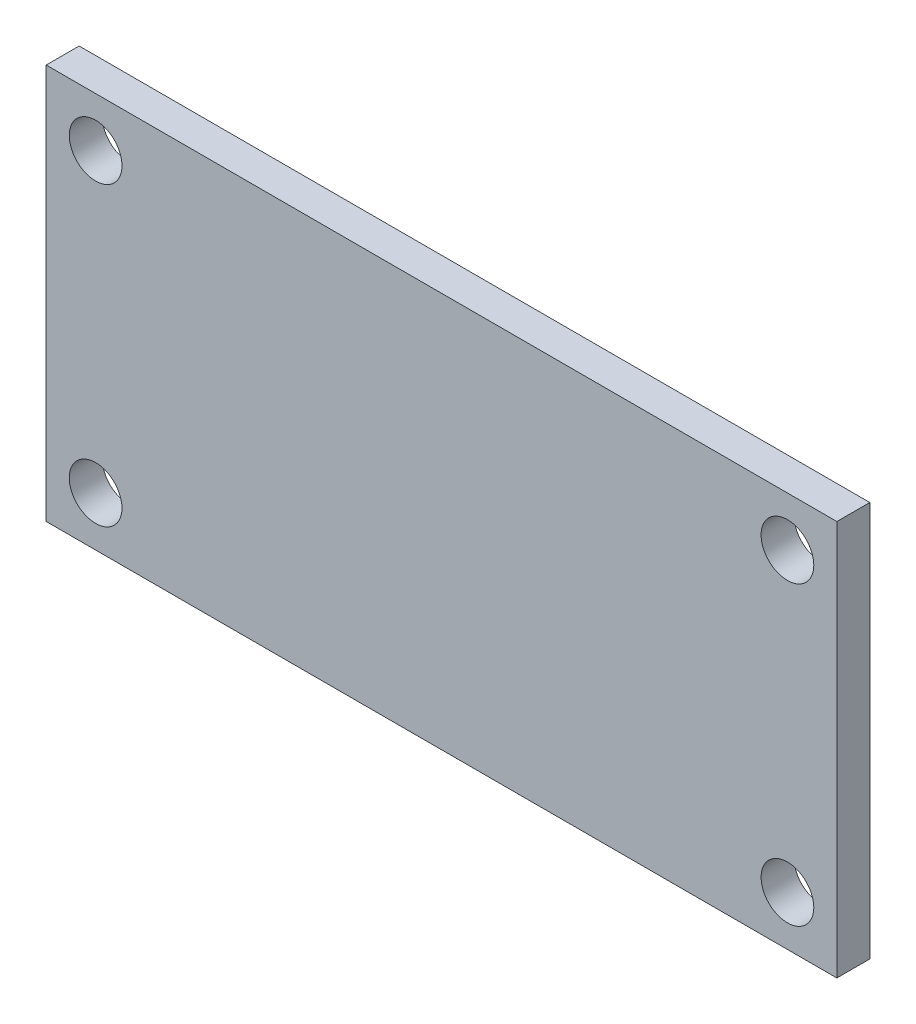
from build123d import *

# Parameters (mm, degrees)
SKETCH_1_W      = 48
SKETCH_1_H      = 24
SKETCH_1_R      = 1.6
EXTRUDE_1_DEPTH = 2


with BuildPart() as part:
    # 草图1 → 凸台-拉伸1 (new body)
    with BuildSketch(Plane.XY):
        with Locations((24, 12)):
            Rectangle(SKETCH_1_W, SKETCH_1_H)
        with Locations((3, 3)):
            Circle(SKETCH_1_R, mode=Mode.SUBTRACT)
        with Locations((3, 21)):
            Circle(SKETCH_1_R, mode=Mode.SUBTRACT)
        with Locations((45, 21)):
            Circle(SKETCH_1_R, mode=Mode.SUBTRACT)
        with Locations((45, 3)):
            Circle(SKETCH_1_R, mode=Mode.SUBTRACT)
    extrude(amount=EXTRUDE_1_DEPTH)


solid = part.part
